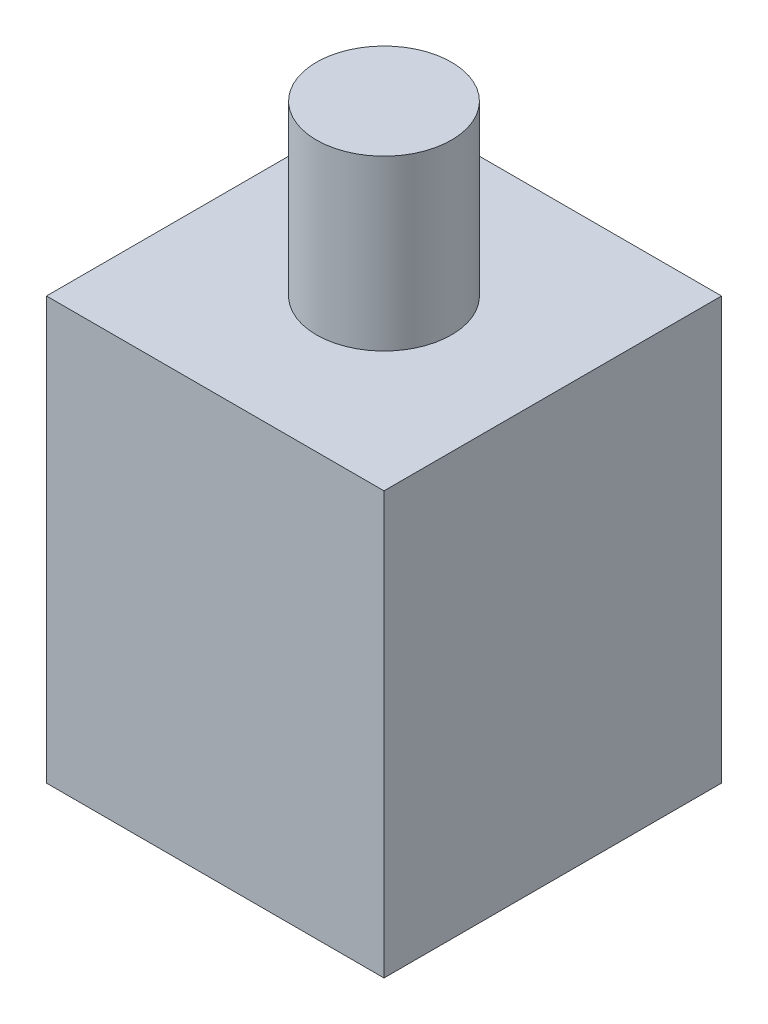
from build123d import *

# Parameters (mm, degrees)
SKETCH_1_W      = 40
SKETCH_1_H      = 40
EXTRUDE_1_DEPTH = 50
SKETCH_2_R      = 8
EXTRUDE_2_DEPTH = 20


with BuildPart() as part:
    # 草图1 → 凸台-拉伸1 (new body)
    with BuildSketch(Plane(origin=(0, 0, 0), x_dir=(1, 0, 0), z_dir=(0, 1, 0))):
        Rectangle(SKETCH_1_W, SKETCH_1_H)
    extrude(amount=EXTRUDE_1_DEPTH)


with BuildPart() as body_2:
    # 草图2 → 凸台-拉伸2 (new body)
    with BuildSketch(Plane(origin=(0, 50, 0), x_dir=(1, 0, 0), z_dir=(0, 1, 0))):
        with Locations(Location((0, 0, 0), (0, 0, 270))):
            Circle(SKETCH_2_R)
    extrude(amount=EXTRUDE_2_DEPTH)


solid = Compound([part.part, body_2.part])
